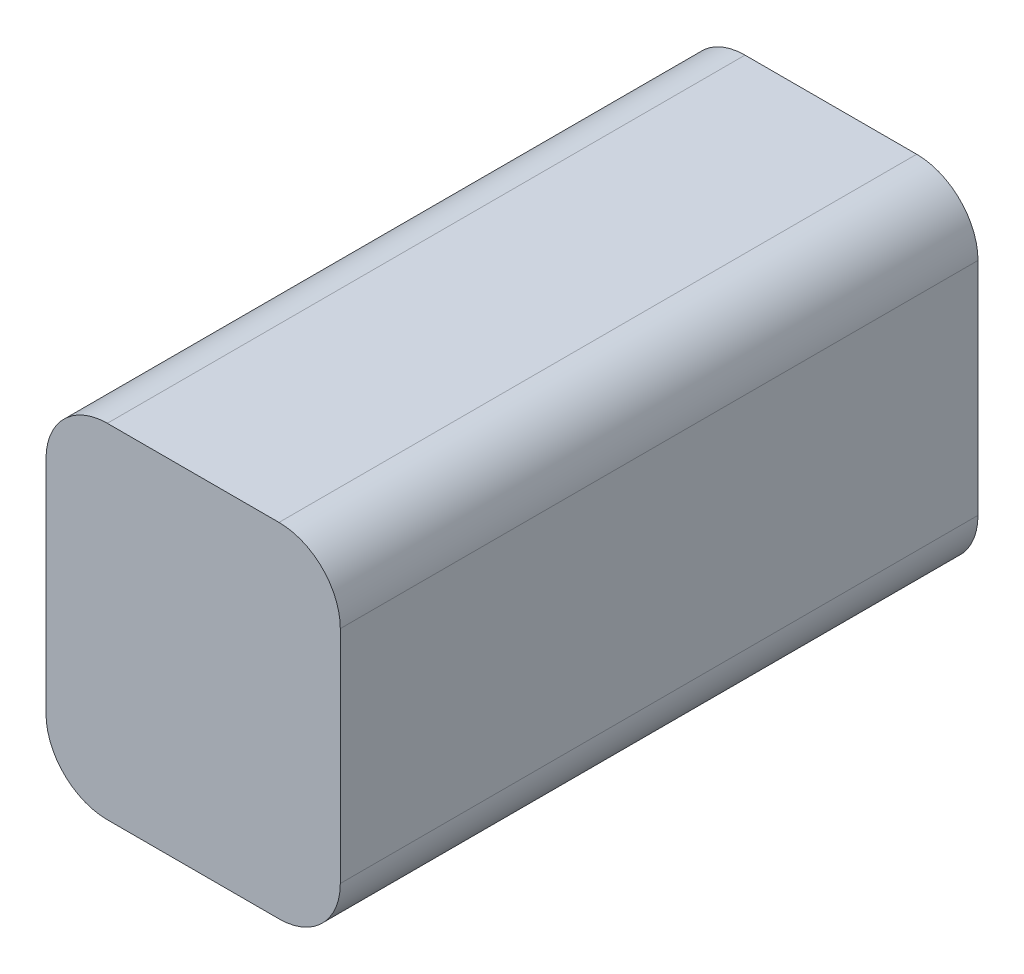
from build123d import *

# Parameters (mm, degrees)
SKETCH1_W           = 24
SKETCH1_H           = 52
BOSS_EXTRUDE1_DEPTH = 28
FILLET1_R           = 5


with BuildPart() as part:
    # Sketch1 → Boss-Extrude1 (new body)
    with BuildSketch(Plane(origin=(0, 0, 0), x_dir=(1, 0, 0), z_dir=(0, 1, 0))):
        Rectangle(SKETCH1_W, SKETCH1_H)
    extrude(amount=BOSS_EXTRUDE1_DEPTH)

    # Fillet1
    fillet1_edges = [part.edges().sort_by_distance(p)[0] for p in [
        (-12, 28, 0),
        (12, 28, 0),
        (-12, 0, 0),
        (12, 0, 0),
    ]]
    fillet(fillet1_edges, radius=FILLET1_R)


solid = part.part
